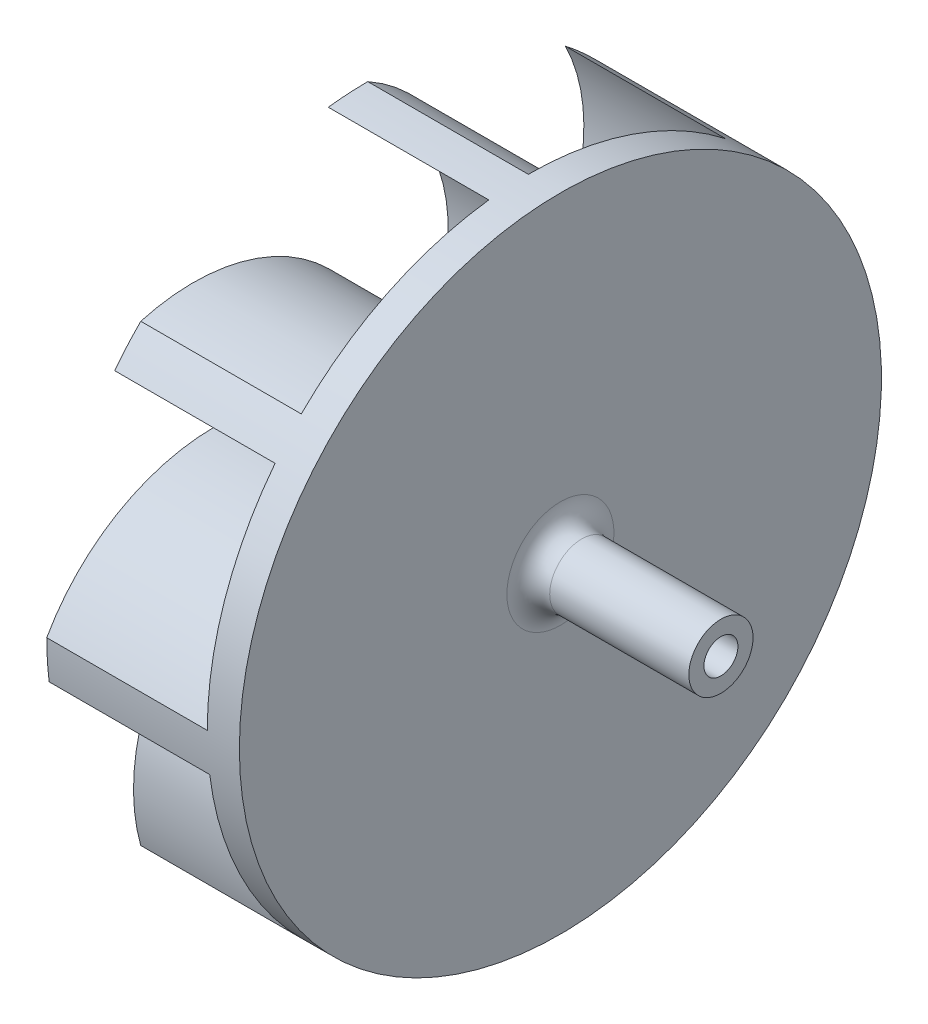
from build123d import *

# Parameters (mm, degrees)
BOSS_EXTRUDE1_START = 15
BOSS_EXTRUDE1_DEPTH = 15
CIRPATTERN1_COUNT   = 8
SKETCH4_R           = 3
BOSS_EXTRUDE2_DEPTH = 15
SKETCH5_R           = 1.58775
CUT_EXTRUDE1_DEPTH  = 11.4
FILLET3_R           = 2


with BuildPart() as part:
    # Sketch1 → Revolve1 (revolve)
    with BuildSketch(Plane(origin=(0, 0, 0), x_dir=(1, 0, 0), z_dir=(0, 1, 0)), mode=Mode.PRIVATE) as revolve1_sk:
        with BuildLine():
            Line((0, 0), (0, 30))
            Line((0, 30), (-3, 30))
            Line((-3, 30), (-3, 5))
            Line((-3, 5), (-8, 5))
            ThreePointArc((-8, 5), (-10.828427125, 3.828427125), (-12, 1))
            Line((-12, 1), (-12, 0))
            Line((-12, 0), (0, 0))
        make_face()
    revolve(revolve1_sk.sketch.rotate(Axis((-12, 0, 0), (1, 0, 0)), 180), axis=Axis((-12, 0, 0), (1, 0, 0)))

    # Sketch2 → Boss-Extrude1 (add)
    with BuildSketch(Plane.ZY.offset(3).offset(BOSS_EXTRUDE1_START)):
        with BuildLine():
            ThreePointArc((-6.74081952, 9.317260982), (-7.459861891, 8.752168906), (-8.131727984, 8.131727984))
            ThreePointArc((-8.131727984, 8.131727984), (-8.088596883, 20.561719247), (0, 30))
            ThreePointArc((0, 30), (1.848623078, 29.942989041), (3.690220038, 29.772172848))
            ThreePointArc((3.690220038, 29.772172848), (-5.738161973, 21.693077802), (-6.74081952, 9.317260982))
        make_face()
    boss_extrude1 = extrude(amount=-BOSS_EXTRUDE1_DEPTH)

    # CirPattern1: Boss-Extrude1 ×8 about axis
    cirpattern1_axis = Axis((0, 0, 0), (1, 0, 0))
    for i in range(1, CIRPATTERN1_COUNT):
        add(boss_extrude1.rotate(cirpattern1_axis, i * 360 / CIRPATTERN1_COUNT))

    # Sketch4 → Boss-Extrude2 (add)
    with BuildSketch(Plane(origin=(0, 0, 0), x_dir=(0, 0, -1), z_dir=(1, 0, 0))):
        with Locations(Location((0, 0, 0), (0, 0, 180))):
            Circle(SKETCH4_R)
    extrude(amount=BOSS_EXTRUDE2_DEPTH)

    # Sketch5 → Cut-Extrude1 (cut)
    with BuildSketch(Plane(origin=(15, 0, 0), x_dir=(0, 0, -1), z_dir=(1, 0, 0))):
        Circle(SKETCH5_R)
    extrude(amount=-CUT_EXTRUDE1_DEPTH, mode=Mode.SUBTRACT)

    # Fillet3
    fillet3_edges = [part.edges().sort_by_distance(p)[0] for p in [
        (0, 0, -3),
    ]]
    fillet(fillet3_edges, radius=FILLET3_R)


solid = part.part
